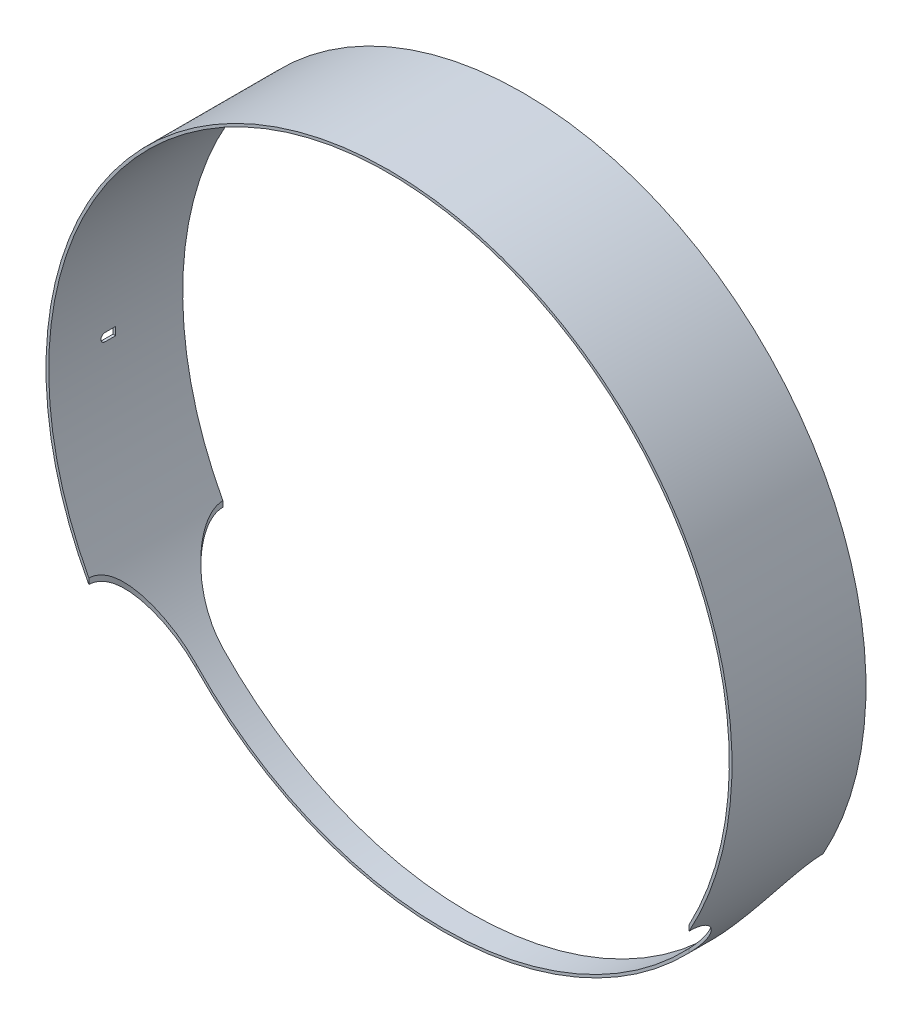
from build123d import *

# Parameters (mm, degrees)
SKETCH_3_R          = 64
SKETCH_3_R_2        = 63.5
EXTRUDE_2_DEPTH     = 25
CUT_EXTRUDE_2_DEPTH = 200
CUT_EXTRUDE_3_DEPTH = 200


with BuildPart() as part:
    # 草图3 → 凸台-拉伸2 (new body)
    with BuildSketch(Plane.XY):
        Circle(SKETCH_3_R)
        Circle(SKETCH_3_R_2, mode=Mode.SUBTRACT)
    extrude(amount=EXTRUDE_2_DEPTH)

    # 草图4 → 切除-拉伸2 (cut)
    with BuildSketch(Plane(origin=(0, 0, 0), x_dir=(1, 0, 0), z_dir=(0, 1, 0))):
        with BuildLine():
            Line((-46, -10), (46, -10))
            ThreePointArc((46, -10), (53.071067812, -7.071067812), (56, 0))
            Line((56, 0), (-56, 0))
            ThreePointArc((-56, 0), (-53.071067812, -7.071067812), (-46, -10))
        make_face()
        with BuildLine():
            Line((-46, -15), (46, -15))
            ThreePointArc((46, -15), (53.071067812, -17.928932188), (56, -25))
            Line((56, -25), (-56, -25))
            ThreePointArc((-56, -25), (-53.071067812, -17.928932188), (-46, -15))
        make_face()
    extrude(amount=-CUT_EXTRUDE_2_DEPTH, mode=Mode.SUBTRACT)

    # 草图6 → 切除-拉伸3 (cut)
    with BuildSketch(Plane(origin=(0, 0, 0), x_dir=(0, 0, -1), z_dir=(1, 0, 0))):
        with BuildLine():
            Line((-12.5, -0.75), (-12.5, 0.75))
            Line((-12.5, 0.75), (-14.5, 0.75))
            ThreePointArc((-14.5, 0.75), (-15.25, 0), (-14.5, -0.75))
            Line((-14.5, -0.75), (-12.5, -0.75))
        make_face()
    extrude(amount=-CUT_EXTRUDE_3_DEPTH, mode=Mode.SUBTRACT)


solid = part.part
